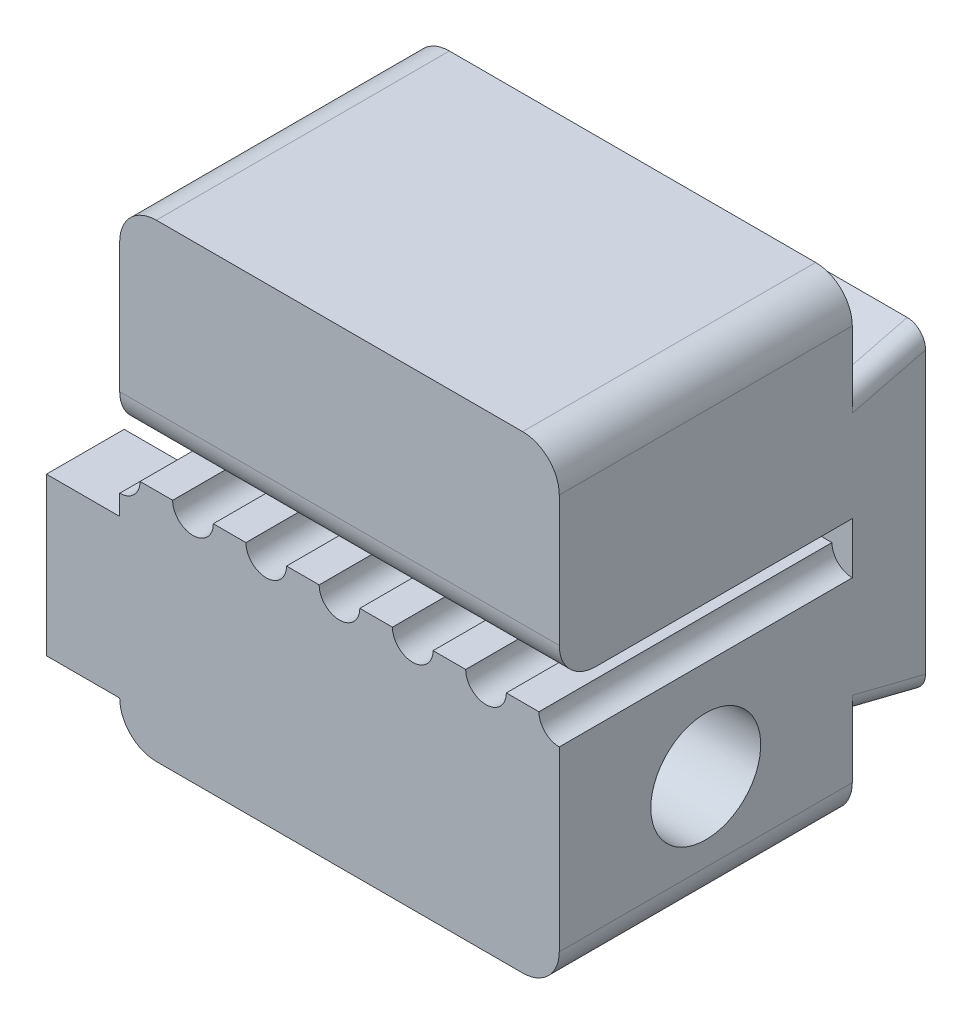
from build123d import *

# Parameters (mm, degrees)
BOSS_EXTRUDE1_DEPTH = 10
CUT_EXTRUDE1_DEPTH  = 8
SKETCH6_R           = 1.5
CUT_EXTRUDE2_DEPTH  = 12
FILLET1_R           = 1
BOSS_EXTRUDE2_DEPTH = 2
FILLET2_R           = 0.5


with BuildPart() as part:
    # Sketch4 → Boss-Extrude1 (new body)
    with BuildSketch(Plane.XY):
        with BuildLine():
            Line((1, 0.1), (11, 0.1))
            ThreePointArc((11, 0.1), (11.707106781, 0.392893219), (12, 1.1))
            Line((12, 1.1), (12, 11.9))
            ThreePointArc((12, 11.9), (11.707106781, 12.607106781), (11, 12.9))
            Line((11, 12.9), (1, 12.9))
            ThreePointArc((1, 12.9), (0.292893219, 12.607106781), (0, 11.9))
            Line((0, 11.9), (0, 1.1))
            ThreePointArc((0, 1.1), (0.292893219, 0.392893219), (1, 0.1))
        make_face()
    extrude(amount=BOSS_EXTRUDE1_DEPTH)

    # Sketch5 → Cut-Extrude1 (cut)
    with BuildSketch(Plane.XY.offset(10)):
        with BuildLine():
            Line((11.445, 6.5), (10.555, 6.5))
            ThreePointArc((10.555, 6.5), (10, 5.945), (9.445, 6.5))
            Line((9.445, 6.5), (8.555, 6.5))
            ThreePointArc((8.555, 6.5), (8, 5.945), (7.445, 6.5))
            Line((7.445, 6.5), (6.555, 6.5))
            ThreePointArc((6.555, 6.5), (6, 5.945), (5.445, 6.5))
            Line((5.445, 6.5), (4.555, 6.5))
            ThreePointArc((4.555, 6.5), (4, 5.945), (3.445, 6.5))
            Line((3.445, 6.5), (2.555, 6.5))
            ThreePointArc((2.555, 6.5), (2, 5.945), (1.445, 6.5))
            Line((1.445, 6.5), (0.555, 6.5))
            ThreePointArc((0.555, 6.5), (0.392444264, 6.107555736), (0, 5.945))
            Line((0, 5.945), (0, 7.345))
            Line((0, 7.345), (12, 7.345))
            Line((12, 7.345), (12, 5.945))
            ThreePointArc((12, 5.945), (11.607555736, 6.107555736), (11.445, 6.5))
        make_face()
    extrude(amount=-CUT_EXTRUDE1_DEPTH, mode=Mode.SUBTRACT)

    # Sketch6 → Cut-Extrude2 (cut)
    with BuildSketch(Plane.ZY):
        with Locations((6, 3.25)):
            Circle(SKETCH6_R)
        Polygon((2, 2.65), (2, 0.1), (0, 0.1), (0, 2.15), align=None)
        Polygon((0, 12.9), (0, 10.85), (2, 10.35), (2, 12.9), align=None)
    extrude(amount=-CUT_EXTRUDE2_DEPTH, mode=Mode.SUBTRACT)

    # Fillet1
    fillet1_edges = [part.edges().sort_by_distance(p)[0] for p in [
        (6, 7.345, 10),
    ]]
    fillet(fillet1_edges, radius=FILLET1_R)

    # Sketch7 → Boss-Extrude2 (add)
    with BuildSketch(Plane.ZY):
        Polygon((7.876388375, 1.1), (9.117691454, 3.25), (7.879275126, 5.395), (10, 5.395), (10, 1.1), align=None)
        Polygon((2, 1.1), (2, 5.395), (4.120724874, 5.395), (2.882308546, 3.25), (4.123611625, 1.1), align=None)
    extrude(amount=BOSS_EXTRUDE2_DEPTH)

    # Fillet2
    fillet2_edges = [part.edges().sort_by_distance(p)[0] for p in [
        (12, 2.4, 1),
        (0, 10.6, 1),
        (12, 10.6, 1),
        (0, 2.4, 1),
    ]]
    fillet(fillet2_edges, radius=FILLET2_R)


solid = part.part
